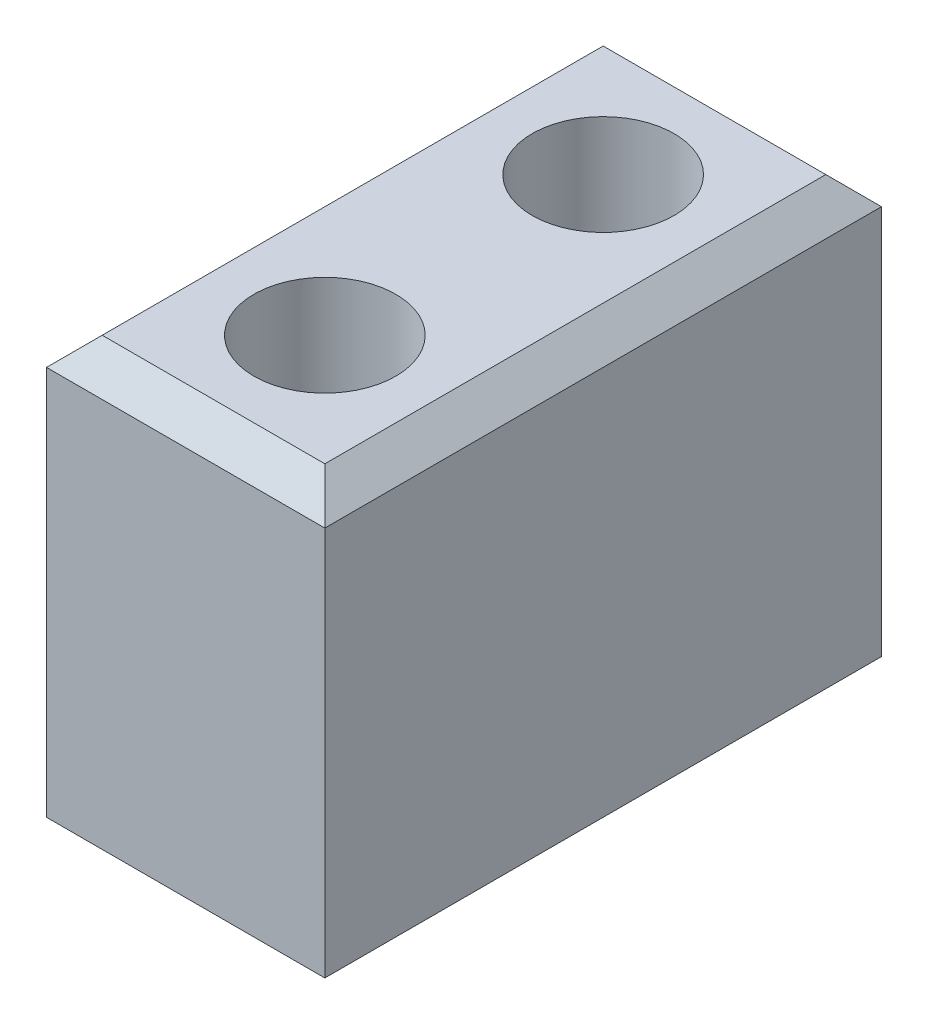
from build123d import *

# Parameters (mm, degrees)
ESBO_O1_W                  = 20
ESBO_O1_H                  = 40
RESSALTO_EXTRUS_O1_DEPTH   = 15
FURO_ROSCADO_DE_M121_D     = 10.2
FURO_ROSCADO_DE_M122_D     = 10.2
FURO_ROSCADO_DE_M122_DEPTH = 25
FURO_ROSCADO_DE_M122_TIP   = 3.064389157
CHANFRO2_SIZE              = 2


with BuildPart() as part:
    # Esboço1 → Ressalto-extrusão1 (new, symmetric)
    with BuildSketch(Plane(origin=(0, 0, 0), x_dir=(1, 0, 0), z_dir=(0, 1, 0))):
        Rectangle(ESBO_O1_W, ESBO_O1_H)
    extrude(amount=RESSALTO_EXTRUS_O1_DEPTH, both=True)

    # Furo roscado de M121 (through all)
    with Locations(Plane(origin=(0, 15, 0), x_dir=(1, 0, 0), z_dir=(0, 1, 0))):
        with Locations((0, 10)):
            Hole(FURO_ROSCADO_DE_M121_D / 2)

    # Furo roscado de M122
    with Locations(Plane(origin=(0, 15, 0), x_dir=(1, 0, 0), z_dir=(0, 1, 0))):
        with Locations((0, -10)):
            Hole(FURO_ROSCADO_DE_M122_D / 2, depth=FURO_ROSCADO_DE_M122_DEPTH)
            with Locations((0, 0, -(FURO_ROSCADO_DE_M122_DEPTH + FURO_ROSCADO_DE_M122_TIP / 2))):  # 118° drill point
                Cone(0, FURO_ROSCADO_DE_M122_D / 2, FURO_ROSCADO_DE_M122_TIP, mode=Mode.SUBTRACT)

    # Chanfro2
    chanfro2_edges = [part.edges().sort_by_distance(p)[0] for p in [
        (-10, 15, 0),
        (0, 15, 20),
        (10, 15, 0),
        (0, 15, -20),
    ]]
    chamfer(chanfro2_edges, length=CHANFRO2_SIZE)


solid = part.part
